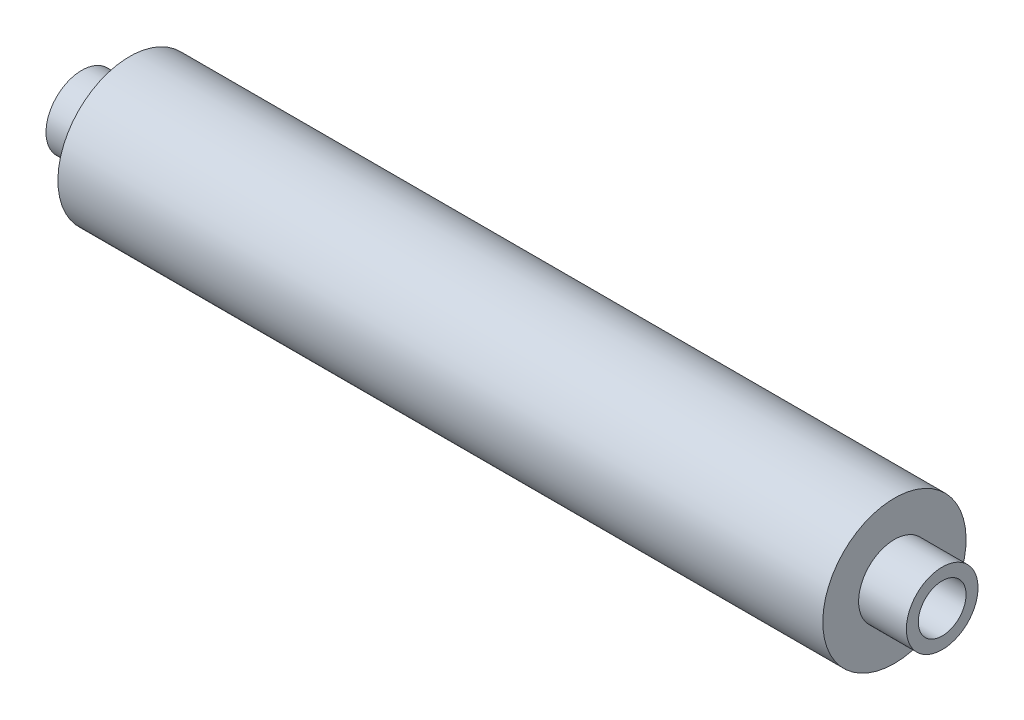
from build123d import *

# Parameters (mm, degrees)
SKETCH2_R          = 2.5
CUT_EXTRUDE1_DEPTH = 20


with BuildPart() as part:
    # Sketch1 → Revolve1 (revolve)
    with BuildSketch(Plane.XY, mode=Mode.PRIVATE) as revolve1_sk:
        Polygon((-45.033, 0), (45.033, 0), (45.033, 3.75), (40.033, 3.75), (40.033, 7.5), (-40.033, 7.5), (-40.033, 3.75), (-45.033, 3.75), align=None)
    revolve(revolve1_sk.sketch.rotate(Axis((-45.033, 0, 0), (1, 0, 0)), 180), axis=Axis((-45.033, 0, 0), (1, 0, 0)))

    # Sketch2 → Cut-Extrude1 (cut)
    with BuildSketch(Plane(origin=(45.033, 0, 0), x_dir=(0, 0, -1), z_dir=(1, 0, 0))):
        Circle(SKETCH2_R)
    cut_extrude1 = extrude(amount=-CUT_EXTRUDE1_DEPTH, mode=Mode.SUBTRACT)

    # Mirror1: Cut-Extrude1 across plane
    add(cut_extrude1.mirror(Plane(origin=(0, 0, 0), x_dir=(0, 0, 1), z_dir=(1, 0, 0))), mode=Mode.SUBTRACT)


solid = part.part
